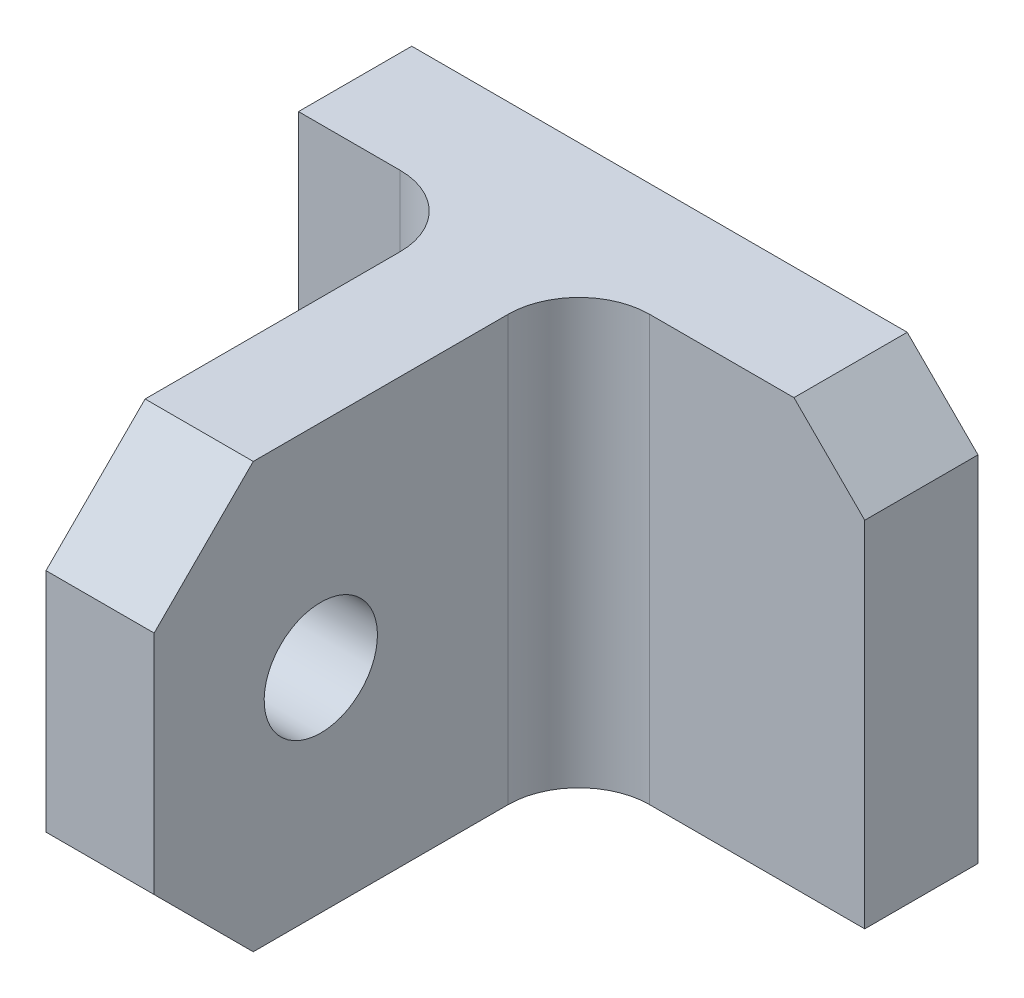
from build123d import *

# Parameters (mm, degrees)
SKETCH_1_W          = 7.64
SKETCH_1_H          = 30
EXTRUDE_1_DEPTH     = 30
SKETCH_2_W          = 40
SKETCH_2_H          = 29.999999992
EXTRUDE_2_DEPTH     = 8
FILLET_1_R          = 5
CHAMFER_1_SIZE      = 7
SKETCH_3_R          = 4
CUT_EXTRUDE_1_DEPTH = 51.742711323
CHAMFER_2_SIZE      = 5


with BuildPart() as part:
    # Эскиз1 → Вытянуть1 (new body)
    with BuildSketch(Plane.XY):
        with Locations((-0.195638171, -15)):
            Rectangle(SKETCH_1_W, SKETCH_1_H)
    extrude(amount=EXTRUDE_1_DEPTH)

    # Эскиз2 → Вытянуть2 (add)
    with BuildSketch(Plane(origin=(0, 0, 0), x_dir=(-1, 0, 0), z_dir=(0, 0, -1))):
        with Locations((-3.82, -14.999999996)):
            Rectangle(SKETCH_2_W, SKETCH_2_H)
    extrude(amount=EXTRUDE_2_DEPTH)

    # Скругление1
    fillet_1_edges = [part.edges().sort_by_distance(p)[0] for p in [
        (-4.015638171, -15, 0),
        (3.624361829, -15, 0),
    ]]
    fillet(fillet_1_edges, radius=FILLET_1_R)

    # Фаска1
    chamfer_1_edges = [part.edges().sort_by_distance(p)[0] for p in [
        (-0.195638171, -30, 30),
        (-0.195638171, 0, 30),
    ]]
    chamfer(chamfer_1_edges, length=CHAMFER_1_SIZE)

    # Эскиз3 → Вырез-Вытянуть1 (cut, through all)
    with BuildSketch(Plane.ZY.offset(4.015638171)):
        with Locations(Location((18.228841689, -15, 0), (0, 0, 270))):
            Circle(SKETCH_3_R)
    extrude(amount=-CUT_EXTRUDE_1_DEPTH, mode=Mode.SUBTRACT)

    # Фаска2
    chamfer_2_edges = [part.edges().sort_by_distance(p)[0] for p in [
        (23.82, 0, -4),
    ]]
    chamfer(chamfer_2_edges, length=CHAMFER_2_SIZE)


solid = part.part
